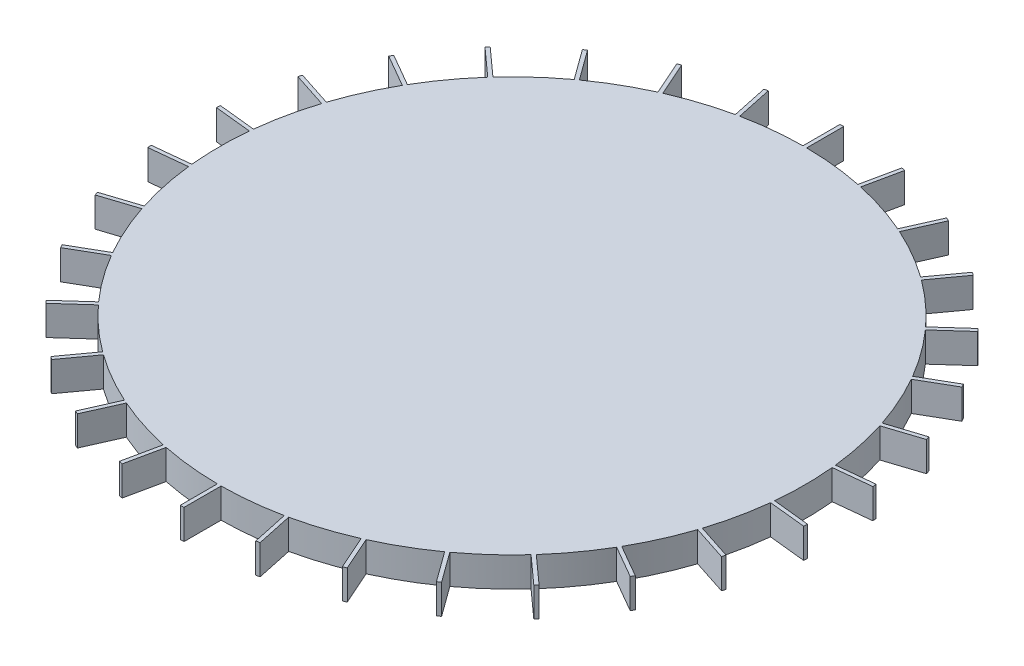
from build123d import *

# Parameters (mm, degrees)
BOSS_EXTRUDE1_DEPTH = 12.7


with BuildPart() as part:
    # Sketch3 → Boss-Extrude1 (new body)
    with BuildSketch(Plane(origin=(0, 0, 0), x_dir=(1, 0, 0), z_dir=(0, 1, 0))):
        with BuildLine():
            Line((-0.79375, 141.285270348), (-0.79375, 125.409988108))
            ThreePointArc((-0.79375, 125.409988108), (-13.1091759, 124.725477203), (-25.297798015, 122.83450888))
            Line((-25.297798015, 122.83450888), (-28.598454788, 138.362878114))
            ThreePointArc((-28.598454788, 138.362878114), (-29.375323016, 138.200029139), (-30.151264104, 138.032818305))
            Line((-30.151264104, 138.032818305), (-26.850607331, 122.504449071))
            ThreePointArc((-26.850607331, 122.504449071), (-38.754593807, 119.27437535), (-50.283710864, 114.890572189))
            Line((-50.283710864, 114.890572189), (-56.74076987, 129.393364168))
            ThreePointArc((-56.74076987, 129.393364168), (-57.466803459, 129.072553847), (-58.191023284, 128.747669747))
            Line((-58.191023284, 128.747669747), (-51.733964278, 114.244877768))
            ThreePointArc((-51.733964278, 114.244877768), (-62.70625, 108.610410952), (-73.071984261, 101.925366188))
            Line((-73.071984261, 101.925366188), (-82.403241037, 114.76873931))
            ThreePointArc((-82.403241037, 114.76873931), (-83.046708833, 114.303988593), (-83.687555516, 113.835630222))
            Line((-83.687555516, 113.835630222), (-74.356298739, 100.9922571))
            ThreePointArc((-74.356298739, 100.9922571), (-83.91734217, 93.199650425), (-92.666661307, 84.505532591))
            Line((-92.666661307, 84.505532591), (-104.464295156, 95.128169822))
            ThreePointArc((-104.464295156, 95.128169822), (-104.99707453, 94.539790546), (-105.526539994, 93.948427412))
            Line((-105.526539994, 93.948427412), (-93.728906144, 83.325790181))
            ThreePointArc((-93.728906144, 83.325790181), (-101.460843807, 73.715617953), (-108.21136059, 63.392401718))
            Line((-108.21136059, 63.392401718), (-121.959758302, 71.330042838))
            ThreePointArc((-121.959758302, 71.330042838), (-122.358564237, 70.64375), (-122.753508302, 69.95522751))
            Line((-122.753508302, 69.95522751), (-109.00511059, 62.01758639))
            ThreePointArc((-109.00511059, 62.01758639), (-114.570019707, 51.00985925), (-119.026704159, 39.508718699))
            Line((-119.026704159, 39.508718699), (-134.124994781, 44.414450702))
            ThreePointArc((-134.124994781, 44.414450702), (-134.372397546, 43.660238593), (-134.61555926, 42.904648482))
            Line((-134.61555926, 42.904648482), (-119.517268638, 37.99891648))
            ThreePointArc((-119.517268638, 37.99891648), (-122.671935977, 26.074724925), (-124.640009603, 13.89831509))
            Line((-124.640009603, 13.89831509), (-140.428325386, 15.557733946))
            ThreePointArc((-140.428325386, 15.557733946), (-140.513512292, 14.768565254), (-140.594264321, 13.978930437))
            Line((-140.594264321, 13.978930437), (-124.805948539, 12.319511581))
            ThreePointArc((-124.805948539, 12.319511581), (-125.4125, 0), (-124.805948539, -12.319511581))
            Line((-124.805948539, -12.319511581), (-140.594264321, -13.978930437))
            ThreePointArc((-140.594264321, -13.978930437), (-140.513512292, -14.768565254), (-140.428325386, -15.557733946))
            Line((-140.428325386, -15.557733946), (-124.640009603, -13.89831509))
            ThreePointArc((-124.640009603, -13.89831509), (-122.671935977, -26.074724925), (-119.517268638, -37.99891648))
            Line((-119.517268638, -37.99891648), (-134.61555926, -42.904648482))
            ThreePointArc((-134.61555926, -42.904648482), (-134.372397546, -43.660238593), (-134.124994781, -44.414450702))
            Line((-134.124994781, -44.414450702), (-119.026704159, -39.508718699))
            ThreePointArc((-119.026704159, -39.508718699), (-114.570019707, -51.00985925), (-109.00511059, -62.01758639))
            Line((-109.00511059, -62.01758639), (-122.753508302, -69.95522751))
            ThreePointArc((-122.753508302, -69.95522751), (-122.358564237, -70.64375), (-121.959758302, -71.330042838))
            Line((-121.959758302, -71.330042838), (-108.21136059, -63.392401718))
            ThreePointArc((-108.21136059, -63.392401718), (-101.460843807, -73.715617953), (-93.728906144, -83.325790181))
            Line((-93.728906144, -83.325790181), (-105.526539994, -93.948427412))
            ThreePointArc((-105.526539994, -93.948427412), (-104.99707453, -94.539790546), (-104.464295156, -95.128169822))
            Line((-104.464295156, -95.128169822), (-92.666661307, -84.505532591))
            ThreePointArc((-92.666661307, -84.505532591), (-83.91734217, -93.199650425), (-74.356298739, -100.9922571))
            Line((-74.356298739, -100.9922571), (-83.687555516, -113.835630222))
            ThreePointArc((-83.687555516, -113.835630222), (-83.046708833, -114.303988593), (-82.403241037, -114.76873931))
            Line((-82.403241037, -114.76873931), (-73.071984261, -101.925366188))
            ThreePointArc((-73.071984261, -101.925366188), (-62.70625, -108.610410952), (-51.733964278, -114.244877768))
            Line((-51.733964278, -114.244877768), (-58.191023284, -128.747669747))
            ThreePointArc((-58.191023284, -128.747669747), (-57.466803459, -129.072553847), (-56.74076987, -129.393364168))
            Line((-56.74076987, -129.393364168), (-50.283710864, -114.890572189))
            ThreePointArc((-50.283710864, -114.890572189), (-38.754593807, -119.27437535), (-26.850607331, -122.504449071))
            Line((-26.850607331, -122.504449071), (-30.151264104, -138.032818305))
            ThreePointArc((-30.151264104, -138.032818305), (-29.375323016, -138.200029139), (-28.598454788, -138.362878114))
            Line((-28.598454788, -138.362878114), (-25.297798015, -122.83450888))
            ThreePointArc((-25.297798015, -122.83450888), (-13.1091759, -124.725477203), (-0.79375, -125.409988108))
            Line((-0.79375, -125.409988108), (-0.79375, -141.285270348))
            ThreePointArc((-0.79375, -141.285270348), (0, -141.2875), (0.79375, -141.285270348))
            Line((0.79375, -141.285270348), (0.79375, -125.409988108))
            ThreePointArc((0.79375, -125.409988108), (13.1091759, -124.725477203), (25.297798015, -122.83450888))
            Line((25.297798015, -122.83450888), (28.598454788, -138.362878114))
            ThreePointArc((28.598454788, -138.362878114), (29.375323016, -138.200029139), (30.151264104, -138.032818305))
            Line((30.151264104, -138.032818305), (26.850607331, -122.504449071))
            ThreePointArc((26.850607331, -122.504449071), (38.754593807, -119.27437535), (50.283710864, -114.890572189))
            Line((50.283710864, -114.890572189), (56.74076987, -129.393364168))
            ThreePointArc((56.74076987, -129.393364168), (57.466803459, -129.072553847), (58.191023284, -128.747669747))
            Line((58.191023284, -128.747669747), (51.733964278, -114.244877768))
            ThreePointArc((51.733964278, -114.244877768), (62.70625, -108.610410952), (73.071984261, -101.925366188))
            Line((73.071984261, -101.925366188), (82.403241037, -114.76873931))
            ThreePointArc((82.403241037, -114.76873931), (83.046708833, -114.303988593), (83.687555516, -113.835630222))
            Line((83.687555516, -113.835630222), (74.356298739, -100.9922571))
            ThreePointArc((74.356298739, -100.9922571), (83.91734217, -93.199650425), (92.666661307, -84.505532591))
            Line((92.666661307, -84.505532591), (104.464295156, -95.128169822))
            ThreePointArc((104.464295156, -95.128169822), (104.99707453, -94.539790546), (105.526539994, -93.948427412))
            Line((105.526539994, -93.948427412), (93.728906144, -83.325790181))
            ThreePointArc((93.728906144, -83.325790181), (101.460843807, -73.715617953), (108.21136059, -63.392401718))
            Line((108.21136059, -63.392401718), (121.959758302, -71.330042838))
            ThreePointArc((121.959758302, -71.330042838), (122.358564237, -70.64375), (122.753508302, -69.95522751))
            Line((122.753508302, -69.95522751), (109.00511059, -62.01758639))
            ThreePointArc((109.00511059, -62.01758639), (114.570019707, -51.00985925), (119.026704159, -39.508718699))
            Line((119.026704159, -39.508718699), (134.124994781, -44.414450702))
            ThreePointArc((134.124994781, -44.414450702), (134.372397546, -43.660238593), (134.61555926, -42.904648482))
            Line((134.61555926, -42.904648482), (119.517268638, -37.99891648))
            ThreePointArc((119.517268638, -37.99891648), (122.671935977, -26.074724925), (124.640009603, -13.89831509))
            Line((124.640009603, -13.89831509), (140.428325386, -15.557733946))
            ThreePointArc((140.428325386, -15.557733946), (140.513512292, -14.768565254), (140.594264321, -13.978930437))
            Line((140.594264321, -13.978930437), (124.805948539, -12.319511581))
            ThreePointArc((124.805948539, -12.319511581), (125.4125, 0), (124.805948539, 12.319511581))
            Line((124.805948539, 12.319511581), (140.594264321, 13.978930437))
            ThreePointArc((140.594264321, 13.978930437), (140.513512292, 14.768565254), (140.428325386, 15.557733946))
            Line((140.428325386, 15.557733946), (124.640009603, 13.89831509))
            ThreePointArc((124.640009603, 13.89831509), (122.671935977, 26.074724925), (119.517268638, 37.99891648))
            Line((119.517268638, 37.99891648), (134.61555926, 42.904648482))
            ThreePointArc((134.61555926, 42.904648482), (134.372397546, 43.660238593), (134.124994781, 44.414450702))
            Line((134.124994781, 44.414450702), (119.026704159, 39.508718699))
            ThreePointArc((119.026704159, 39.508718699), (114.570019707, 51.00985925), (109.00511059, 62.01758639))
            Line((109.00511059, 62.01758639), (122.753508302, 69.95522751))
            ThreePointArc((122.753508302, 69.95522751), (122.358564237, 70.64375), (121.959758302, 71.330042838))
            Line((121.959758302, 71.330042838), (108.21136059, 63.392401718))
            ThreePointArc((108.21136059, 63.392401718), (101.460843807, 73.715617953), (93.728906144, 83.325790181))
            Line((93.728906144, 83.325790181), (105.526539994, 93.948427412))
            ThreePointArc((105.526539994, 93.948427412), (104.99707453, 94.539790546), (104.464295156, 95.128169822))
            Line((104.464295156, 95.128169822), (92.666661307, 84.505532591))
            ThreePointArc((92.666661307, 84.505532591), (83.91734217, 93.199650425), (74.356298739, 100.9922571))
            Line((74.356298739, 100.9922571), (83.687555516, 113.835630222))
            ThreePointArc((83.687555516, 113.835630222), (83.046708833, 114.303988593), (82.403241037, 114.76873931))
            Line((82.403241037, 114.76873931), (73.071984261, 101.925366188))
            ThreePointArc((73.071984261, 101.925366188), (62.70625, 108.610410952), (51.733964278, 114.244877768))
            Line((51.733964278, 114.244877768), (58.191023284, 128.747669747))
            ThreePointArc((58.191023284, 128.747669747), (57.466803459, 129.072553847), (56.74076987, 129.393364168))
            Line((56.74076987, 129.393364168), (50.283710864, 114.890572189))
            ThreePointArc((50.283710864, 114.890572189), (38.754593807, 119.27437535), (26.850607331, 122.504449071))
            Line((26.850607331, 122.504449071), (30.151264104, 138.032818305))
            ThreePointArc((30.151264104, 138.032818305), (29.375323016, 138.200029139), (28.598454788, 138.362878114))
            Line((28.598454788, 138.362878114), (25.297798015, 122.83450888))
            ThreePointArc((25.297798015, 122.83450888), (13.1091759, 124.725477203), (0.79375, 125.409988108))
            Line((0.79375, 125.409988108), (0.79375, 141.285270348))
            ThreePointArc((0.79375, 141.285270348), (0, 141.2875), (-0.79375, 141.285270348))
        make_face()
    extrude(amount=BOSS_EXTRUDE1_DEPTH)


solid = part.part
